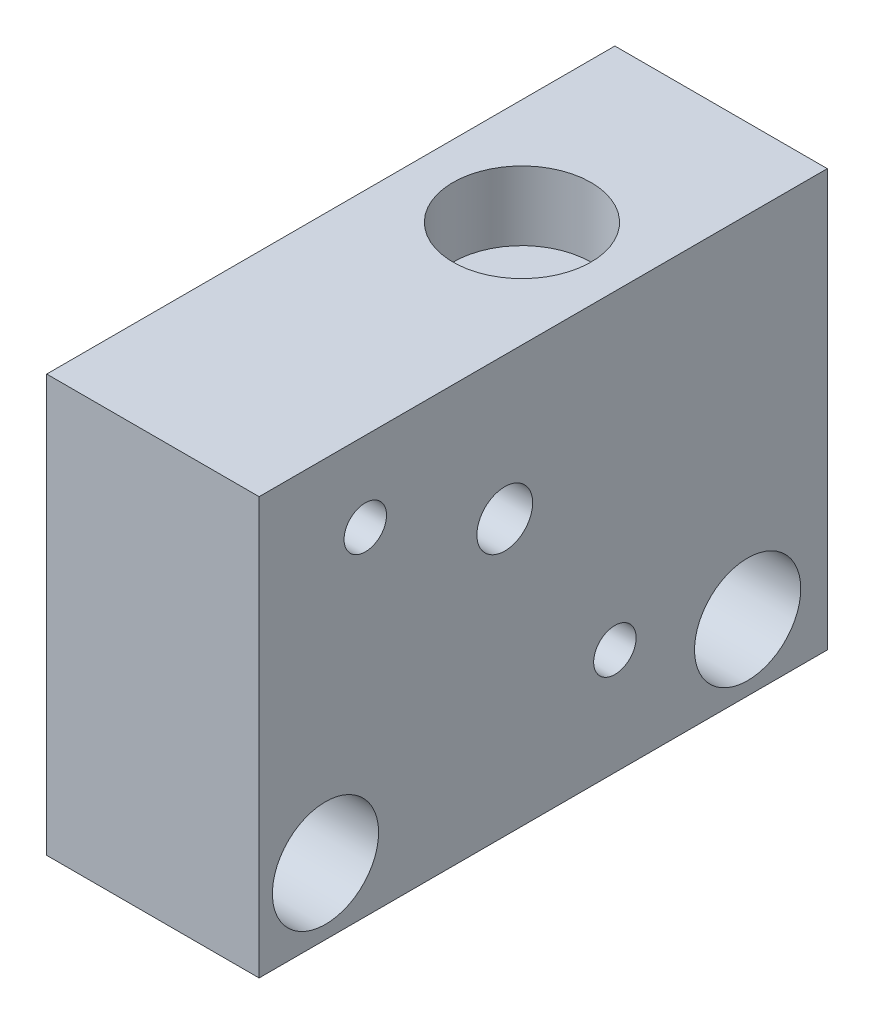
from build123d import *

# Parameters (mm, degrees)
SKETCH_1_W          = 8
SKETCH_1_H          = 21.4
EXTRUDE_1_DEPTH     = 15.7
CUT_EXTRUDE_START   = 15.7
SKETCH_1_18_R       = 2.6
CUT_EXTRUDE_1_DEPTH = 2.6
SKETCH_2_R          = 1.05
CUT_EXTRUDE_2_DEPTH = 23.443261795
SKETCH_3_R          = 2
CUT_EXTRUDE_4_DEPTH = 6
SKETCH_3_4_R        = 1.5
CUT_EXTRUDE_5_DEPTH = 23.443261795
SKETCH_4_R          = 0.8
CUT_EXTRUDE_6_DEPTH = 4


with BuildPart() as part:
    # 草图1 → 凸台-拉伸1 (new body)
    with BuildSketch(Plane(origin=(0, 0, 0), x_dir=(1, 0, 0), z_dir=(0, 1, 0))):
        with Locations((0, -3.2)):
            Rectangle(SKETCH_1_W, SKETCH_1_H)
    extrude(amount=EXTRUDE_1_DEPTH)

    # 草图1<18> → 切除-拉伸1 (cut)
    with BuildSketch(Plane(origin=(0, 0, 0), x_dir=(1, 0, 0), z_dir=(0, 1, 0)).offset(CUT_EXTRUDE_START)):
        with Locations(Location((0, 0, 0), (0, 0, 90))):
            Circle(SKETCH_1_18_R)
    extrude(amount=-CUT_EXTRUDE_1_DEPTH, mode=Mode.SUBTRACT)

    # 草图2 → 切除-拉伸2 (cut, through all)
    with BuildSketch(Plane.ZY.offset(4)):
        with Locations((4.646826988, 10.35029737)):
            Circle(SKETCH_2_R)
    extrude(amount=-CUT_EXTRUDE_2_DEPTH, mode=Mode.SUBTRACT)

    # 草图3 → 切除-拉伸4 (cut)
    with BuildSketch(Plane(origin=(4, 0, 0), x_dir=(0, 0, -1), z_dir=(1, 0, 0))):
        with Locations((4.5, 2.5)):
            Circle(SKETCH_3_R)
        with Locations((-11.4, 2.5)):
            Circle(SKETCH_3_R)
    extrude(amount=-CUT_EXTRUDE_4_DEPTH, mode=Mode.SUBTRACT)

    # 草图3<4> → 切除-拉伸5 (cut, through all)
    with BuildSketch(Plane(origin=(4, 0, 0), x_dir=(0, 0, -1), z_dir=(1, 0, 0))):
        with Locations((4.5, 2.5)):
            Circle(SKETCH_3_4_R)
        with Locations((-11.4, 2.5)):
            Circle(SKETCH_3_4_R)
    extrude(amount=-CUT_EXTRUDE_5_DEPTH, mode=Mode.SUBTRACT)

    # 草图4 → 切除-拉伸6 (cut)
    with BuildSketch(Plane(origin=(4, 0, 0), x_dir=(0, 0, -1), z_dir=(1, 0, 0))):
        with Locations((-0.5, 4)):
            Circle(SKETCH_4_R)
        with Locations((-9.9, 12.7)):
            Circle(SKETCH_4_R)
    extrude(amount=-CUT_EXTRUDE_6_DEPTH, mode=Mode.SUBTRACT)


solid = part.part
